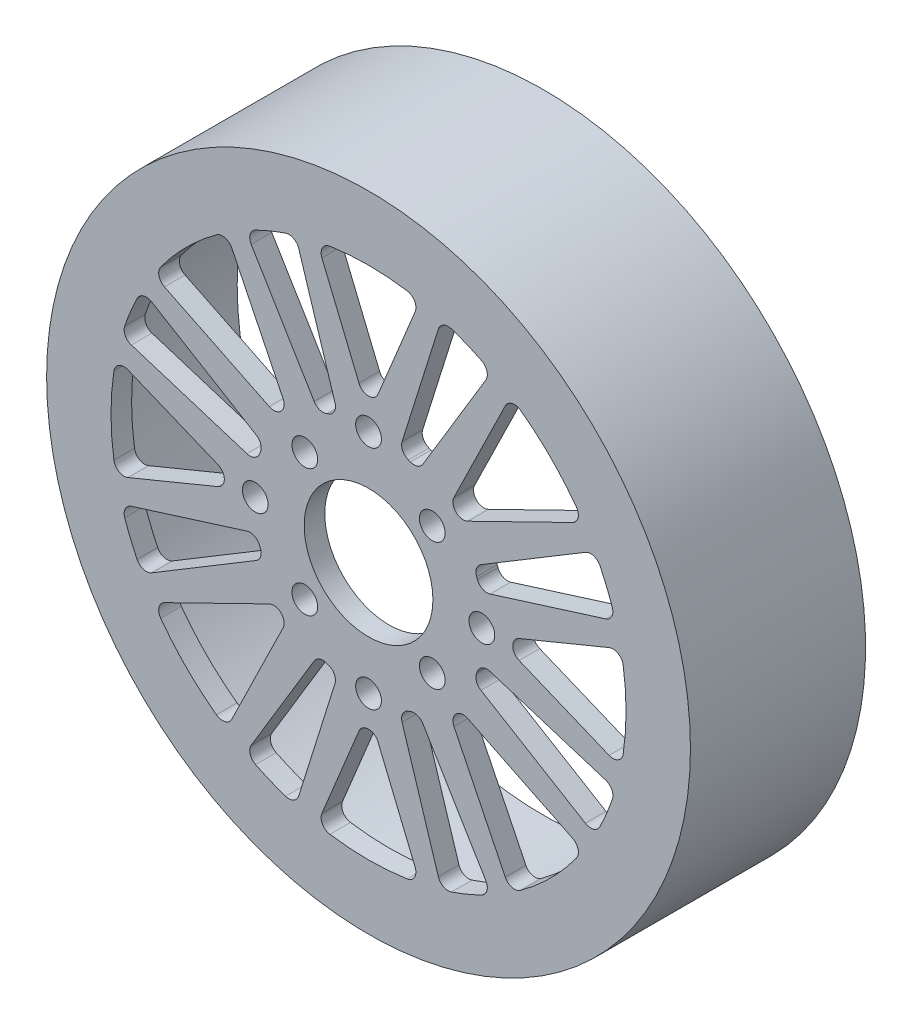
from build123d import *

# Parameters (mm, degrees)
SKETCH_1_R          = 72.5
SKETCH_1_R_2        = 2.5
EXTRUDE_1_DEPTH     = 2
SKETCH_2_R          = 12.5
CUT_EXTRUDE_1_DEPTH = 4
SKETCH_3_R          = 72.5
SKETCH_3_R_2        = 59.5
EXTRUDE_2_DEPTH     = 30
CUT_EXTRUDE_START   = -44
SKETCH_4_R          = 72.5
SKETCH_4_R_2        = 62.5
CUT_EXTRUDE_2_DEPTH = 44
CUT_EXTRUDE_3_DEPTH = 44


with BuildPart() as part:
    # 草图1 → 凸台-拉伸1 (new, symmetric)
    with BuildSketch(Plane.XY):
        Circle(SKETCH_1_R)
        with Locations((0, 22)):
            Circle(SKETCH_1_R_2, mode=Mode.SUBTRACT)
        with Locations((12.374368671, 12.374368671)):
            Circle(SKETCH_1_R_2, mode=Mode.SUBTRACT)
        with Locations((22, 0)):
            Circle(SKETCH_1_R_2, mode=Mode.SUBTRACT)
        with Locations((12.374368671, -12.374368671)):
            Circle(SKETCH_1_R_2, mode=Mode.SUBTRACT)
        with Locations((0, -22)):
            Circle(SKETCH_1_R_2, mode=Mode.SUBTRACT)
        with Locations((-12.374368671, -12.374368671)):
            Circle(SKETCH_1_R_2, mode=Mode.SUBTRACT)
        with Locations((-22, 0)):
            Circle(SKETCH_1_R_2, mode=Mode.SUBTRACT)
        with Locations((-12.374368671, 12.374368671)):
            Circle(SKETCH_1_R_2, mode=Mode.SUBTRACT)
    extrude(amount=EXTRUDE_1_DEPTH, both=True)

    # 草图2 → 切除-拉伸1 (cut)
    with BuildSketch(Plane.XY.offset(2)):
        Circle(SKETCH_2_R)
    extrude(amount=-CUT_EXTRUDE_1_DEPTH, mode=Mode.SUBTRACT)

    # 草图3 → 凸台-拉伸2 (add)
    with BuildSketch(Plane(origin=(0, 0, -2), x_dir=(-1, 0, 0), z_dir=(0, 0, -1))):
        Circle(SKETCH_3_R)
        Circle(SKETCH_3_R_2, mode=Mode.SUBTRACT)
    extrude(amount=EXTRUDE_2_DEPTH)

    # 草图4 → 切除-拉伸2 (cut)
    with BuildSketch(Plane(origin=(0, 0, -32), x_dir=(-1, 0, 0), z_dir=(0, 0, -1)).offset(CUT_EXTRUDE_START)):
        Circle(SKETCH_4_R)
        Circle(SKETCH_4_R_2, mode=Mode.SUBTRACT)
    extrude(amount=CUT_EXTRUDE_2_DEPTH, mode=Mode.SUBTRACT)

    # 草图5 → 切除-拉伸3 (cut)
    with BuildSketch(Plane(origin=(0, 0, -2), x_dir=(-1, 0, 0), z_dir=(0, 0, -1))):
        with BuildLine():
            Line((-9.052385327, 46.693458718), (-1.848770467, 29.237079453))
            ThreePointArc((-1.848770467, 29.237079453), (0, 28), (1.848770467, 29.237079453))
            Line((1.848770467, 29.237079453), (9.052385327, 46.693458718))
            ThreePointArc((9.052385327, 46.693458718), (8.944802657, 48.440383868), (7.50376548, 49.433728401))
            ThreePointArc((7.50376548, 49.433728401), (0, 50), (-7.50376548, 49.433728401))
            ThreePointArc((-7.50376548, 49.433728401), (-8.944802657, 48.440383868), (-9.052385327, 46.693458718))
        make_face()
        with BuildLine():
            Line((-13.553167257, 46.040555084), (-6.512327159, 23.606368847))
            ThreePointArc((-6.512327159, 23.606368847), (-6.626606267, 22.123318115), (-7.733163126, 21.129320578))
            ThreePointArc((-7.733163126, 21.129320578), (-7.928204908, 21.056912569), (-8.122568831, 20.982704201))
            ThreePointArc((-8.122568831, 20.982704201), (-9.491921374, 20.955495595), (-10.557690017, 21.815730385))
            Line((-10.557690017, 21.815730385), (-22.7777165, 42.098890031))
            ThreePointArc((-22.7777165, 42.098890031), (-22.98272615, 43.69738305), (-21.942293158, 44.928117821))
            ThreePointArc((-21.942293158, 44.928117821), (-19.061985374, 46.223811111), (-16.105620314, 47.335071504))
            ThreePointArc((-16.105620314, 47.335071504), (-14.556757806, 47.225381244), (-13.553167257, 46.040555084))
        make_face()
        with BuildLine():
            Line((13.553167257, 46.040555084), (6.512327159, 23.606368847))
            ThreePointArc((6.512327159, 23.606368847), (6.626606267, 22.123318115), (7.733163126, 21.129320578))
            ThreePointArc((7.733163126, 21.129320578), (7.928204908, 21.056912569), (8.122568831, 20.982704201))
            ThreePointArc((8.122568831, 20.982704201), (9.491921374, 20.955495595), (10.557690017, 21.815730385))
            Line((10.557690017, 21.815730385), (22.7777165, 42.098890031))
            ThreePointArc((22.7777165, 42.098890031), (22.98272615, 43.69738305), (21.942293158, 44.928117821))
            ThreePointArc((21.942293158, 44.928117821), (19.061985374, 46.223811111), (16.105620314, 47.335071504))
            ThreePointArc((16.105620314, 47.335071504), (14.556757806, 47.225381244), (13.553167257, 46.040555084))
        make_face()
        with BuildLine():
            Line((46.693458718, 9.052385327), (29.237079453, 1.848770467))
            ThreePointArc((29.237079453, 1.848770467), (28, 0), (29.237079453, -1.848770467))
            Line((29.237079453, -1.848770467), (46.693458718, -9.052385327))
            ThreePointArc((46.693458718, -9.052385327), (48.440383868, -8.944802657), (49.433728401, -7.50376548))
            ThreePointArc((49.433728401, -7.50376548), (50, 0), (49.433728401, 7.50376548))
            ThreePointArc((49.433728401, 7.50376548), (48.440383868, 8.944802657), (46.693458718, 9.052385327))
        make_face()
        with BuildLine():
            Line((46.040555084, -13.553167257), (23.606368847, -6.512327159))
            ThreePointArc((23.606368847, -6.512327159), (22.123318115, -6.626606267), (21.129320578, -7.733163126))
            ThreePointArc((21.129320578, -7.733163126), (21.056912569, -7.928204908), (20.982704201, -8.122568831))
            ThreePointArc((20.982704201, -8.122568831), (20.955495595, -9.491921374), (21.815730385, -10.557690017))
            Line((21.815730385, -10.557690017), (42.098890031, -22.7777165))
            ThreePointArc((42.098890031, -22.7777165), (43.69738305, -22.98272615), (44.928117821, -21.942293158))
            ThreePointArc((44.928117821, -21.942293158), (46.223811111, -19.061985374), (47.335071504, -16.105620314))
            ThreePointArc((47.335071504, -16.105620314), (47.225381244, -14.556757806), (46.040555084, -13.553167257))
        make_face()
        with BuildLine():
            Line((46.040555084, 13.553167257), (23.606368847, 6.512327159))
            ThreePointArc((23.606368847, 6.512327159), (22.123318115, 6.626606267), (21.129320578, 7.733163126))
            ThreePointArc((21.129320578, 7.733163126), (21.056912569, 7.928204908), (20.982704201, 8.122568831))
            ThreePointArc((20.982704201, 8.122568831), (20.955495595, 9.491921374), (21.815730385, 10.557690017))
            Line((21.815730385, 10.557690017), (42.098890031, 22.7777165))
            ThreePointArc((42.098890031, 22.7777165), (43.69738305, 22.98272615), (44.928117821, 21.942293158))
            ThreePointArc((44.928117821, 21.942293158), (46.223811111, 19.061985374), (47.335071504, 16.105620314))
            ThreePointArc((47.335071504, 16.105620314), (47.225381244, 14.556757806), (46.040555084, 13.553167257))
        make_face()
        with BuildLine():
            Line((9.052385327, -46.693458718), (1.848770467, -29.237079453))
            ThreePointArc((1.848770467, -29.237079453), (0, -28), (-1.848770467, -29.237079453))
            Line((-1.848770467, -29.237079453), (-9.052385327, -46.693458718))
            ThreePointArc((-9.052385327, -46.693458718), (-8.944802657, -48.440383868), (-7.50376548, -49.433728401))
            ThreePointArc((-7.50376548, -49.433728401), (0, -50), (7.50376548, -49.433728401))
            ThreePointArc((7.50376548, -49.433728401), (8.944802657, -48.440383868), (9.052385327, -46.693458718))
        make_face()
        with BuildLine():
            Line((-13.553167257, -46.040555084), (-6.512327159, -23.606368847))
            ThreePointArc((-6.512327159, -23.606368847), (-6.626606267, -22.123318115), (-7.733163126, -21.129320578))
            ThreePointArc((-7.733163126, -21.129320578), (-7.928204908, -21.056912569), (-8.122568831, -20.982704201))
            ThreePointArc((-8.122568831, -20.982704201), (-9.491921374, -20.955495595), (-10.557690017, -21.815730385))
            Line((-10.557690017, -21.815730385), (-22.7777165, -42.098890031))
            ThreePointArc((-22.7777165, -42.098890031), (-22.98272615, -43.69738305), (-21.942293158, -44.928117821))
            ThreePointArc((-21.942293158, -44.928117821), (-19.061985374, -46.223811111), (-16.105620314, -47.335071504))
            ThreePointArc((-16.105620314, -47.335071504), (-14.556757806, -47.225381244), (-13.553167257, -46.040555084))
        make_face()
        with BuildLine():
            Line((13.553167257, -46.040555084), (6.512327159, -23.606368847))
            ThreePointArc((6.512327159, -23.606368847), (6.626606267, -22.123318115), (7.733163126, -21.129320578))
            ThreePointArc((7.733163126, -21.129320578), (7.928204908, -21.056912569), (8.122568831, -20.982704201))
            ThreePointArc((8.122568831, -20.982704201), (9.491921374, -20.955495595), (10.557690017, -21.815730385))
            Line((10.557690017, -21.815730385), (22.7777165, -42.098890031))
            ThreePointArc((22.7777165, -42.098890031), (22.98272615, -43.69738305), (21.942293158, -44.928117821))
            ThreePointArc((21.942293158, -44.928117821), (19.061985374, -46.223811111), (16.105620314, -47.335071504))
            ThreePointArc((16.105620314, -47.335071504), (14.556757806, -47.225381244), (13.553167257, -46.040555084))
        make_face()
        with BuildLine():
            Line((-46.693458718, -9.052385327), (-29.237079453, -1.848770467))
            ThreePointArc((-29.237079453, -1.848770467), (-28, 0), (-29.237079453, 1.848770467))
            Line((-29.237079453, 1.848770467), (-46.693458718, 9.052385327))
            ThreePointArc((-46.693458718, 9.052385327), (-48.440383868, 8.944802657), (-49.433728401, 7.50376548))
            ThreePointArc((-49.433728401, 7.50376548), (-50, 0), (-49.433728401, -7.50376548))
            ThreePointArc((-49.433728401, -7.50376548), (-48.440383868, -8.944802657), (-46.693458718, -9.052385327))
        make_face()
        with BuildLine():
            Line((-46.040555084, 13.553167257), (-23.606368847, 6.512327159))
            ThreePointArc((-23.606368847, 6.512327159), (-22.123318115, 6.626606267), (-21.129320578, 7.733163126))
            ThreePointArc((-21.129320578, 7.733163126), (-21.056912569, 7.928204908), (-20.982704201, 8.122568831))
            ThreePointArc((-20.982704201, 8.122568831), (-20.955495595, 9.491921374), (-21.815730385, 10.557690017))
            Line((-21.815730385, 10.557690017), (-42.098890031, 22.7777165))
            ThreePointArc((-42.098890031, 22.7777165), (-43.69738305, 22.98272615), (-44.928117821, 21.942293158))
            ThreePointArc((-44.928117821, 21.942293158), (-46.223811111, 19.061985374), (-47.335071504, 16.105620314))
            ThreePointArc((-47.335071504, 16.105620314), (-47.225381244, 14.556757806), (-46.040555084, 13.553167257))
        make_face()
        with BuildLine():
            Line((-46.040555084, -13.553167257), (-23.606368847, -6.512327159))
            ThreePointArc((-23.606368847, -6.512327159), (-22.123318115, -6.626606267), (-21.129320578, -7.733163126))
            ThreePointArc((-21.129320578, -7.733163126), (-21.056912569, -7.928204908), (-20.982704201, -8.122568831))
            ThreePointArc((-20.982704201, -8.122568831), (-20.955495595, -9.491921374), (-21.815730385, -10.557690017))
            Line((-21.815730385, -10.557690017), (-42.098890031, -22.7777165))
            ThreePointArc((-42.098890031, -22.7777165), (-43.69738305, -22.98272615), (-44.928117821, -21.942293158))
            ThreePointArc((-44.928117821, -21.942293158), (-46.223811111, -19.061985374), (-47.335071504, -16.105620314))
            ThreePointArc((-47.335071504, -16.105620314), (-47.225381244, -14.556757806), (-46.040555084, -13.553167257))
        make_face()
        with BuildLine():
            Line((-16.588226452, 19.263644109), (-26.545556797, 39.618059714))
            ThreePointArc((-26.545556797, 39.618059714), (-27.862624209, 40.680865571), (-29.523027766, 40.353324913))
            ThreePointArc((-29.523027766, 40.353324913), (-35.355339059, 35.355339059), (-40.353324913, 29.523027766))
            ThreePointArc((-40.353324913, 29.523027766), (-40.680865571, 27.862624209), (-39.618059714, 26.545556797))
            Line((-39.618059714, 26.545556797), (-19.263644109, 16.588226452))
            ThreePointArc((-19.263644109, 16.588226452), (-16.970562748, 16.970562748), (-16.588226452, 19.263644109))
        make_face()
        with BuildLine():
            Line((19.263644109, 16.588226452), (39.618059714, 26.545556797))
            ThreePointArc((39.618059714, 26.545556797), (40.680865571, 27.862624209), (40.353324913, 29.523027766))
            ThreePointArc((40.353324913, 29.523027766), (35.355339059, 35.355339059), (29.523027766, 40.353324913))
            ThreePointArc((29.523027766, 40.353324913), (27.862624209, 40.680865571), (26.545556797, 39.618059714))
            Line((26.545556797, 39.618059714), (16.588226452, 19.263644109))
            ThreePointArc((16.588226452, 19.263644109), (16.970562748, 16.970562748), (19.263644109, 16.588226452))
        make_face()
        with BuildLine():
            Line((16.588226452, -19.263644109), (26.545556797, -39.618059714))
            ThreePointArc((26.545556797, -39.618059714), (27.862624209, -40.680865571), (29.523027766, -40.353324913))
            ThreePointArc((29.523027766, -40.353324913), (35.355339059, -35.355339059), (40.353324913, -29.523027766))
            ThreePointArc((40.353324913, -29.523027766), (40.680865571, -27.862624209), (39.618059714, -26.545556797))
            Line((39.618059714, -26.545556797), (19.263644109, -16.588226452))
            ThreePointArc((19.263644109, -16.588226452), (16.970562748, -16.970562748), (16.588226452, -19.263644109))
        make_face()
        with BuildLine():
            Line((-19.263644109, -16.588226452), (-39.618059714, -26.545556797))
            ThreePointArc((-39.618059714, -26.545556797), (-40.680865571, -27.862624209), (-40.353324913, -29.523027766))
            ThreePointArc((-40.353324913, -29.523027766), (-35.355339059, -35.355339059), (-29.523027766, -40.353324913))
            ThreePointArc((-29.523027766, -40.353324913), (-27.862624209, -40.680865571), (-26.545556797, -39.618059714))
            Line((-26.545556797, -39.618059714), (-16.588226452, -19.263644109))
            ThreePointArc((-16.588226452, -19.263644109), (-16.970562748, -16.970562748), (-19.263644109, -16.588226452))
        make_face()
    extrude(amount=-CUT_EXTRUDE_3_DEPTH, mode=Mode.SUBTRACT)


solid = part.part
